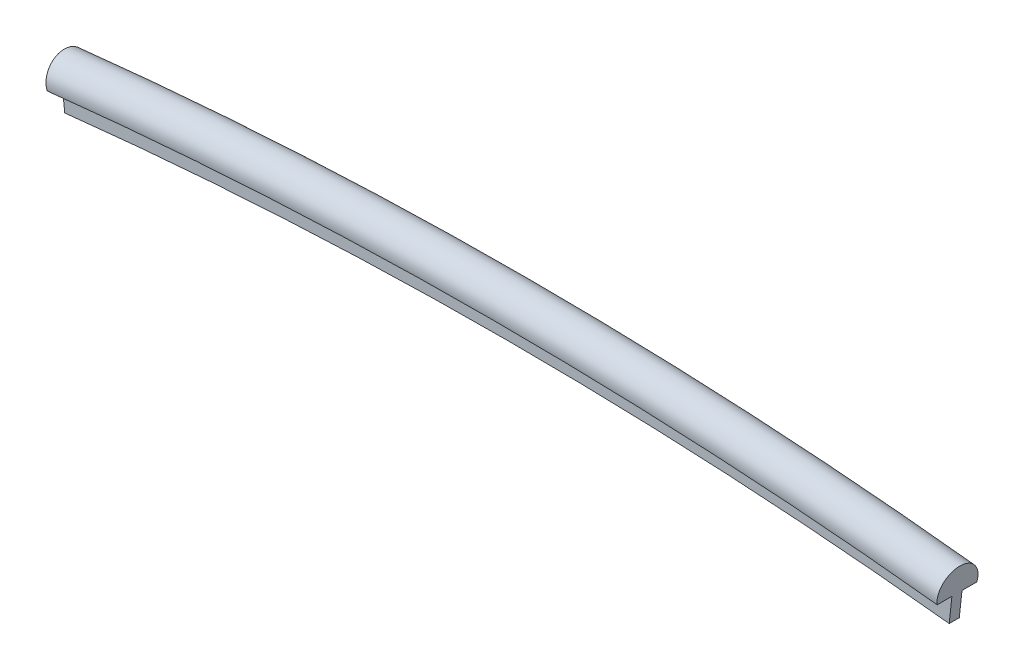
from build123d import *

# Parameters (mm, degrees)
REVOLVE1_ANGLE           = 6.308952124
REVOLVE1_OTHER_WAY_ANGLE = 6.308952124


with BuildPart() as part:
    # Sketch2 → Revolve1 (revolve)
    with BuildSketch(Plane(origin=(0, 0, 0), x_dir=(0, 0, -1), z_dir=(1, 0, 0))):
        with BuildLine():
            Line((0, 239.8), (0.3, 239.8))
            Line((0.3, 239.8), (0.3, 241.3))
            Line((0.3, 241.3), (1.18, 241.3))
            ThreePointArc((1.18, 241.3), (0, 242.800182019), (-1.18, 241.3))
            Line((-1.18, 241.3), (-0.3, 241.3))
            Line((-0.3, 241.3), (-0.3, 239.8))
            Line((-0.3, 239.8), (0, 239.8))
        make_face()
    revolve(axis=Axis((0, 0, 70.597641597), (0, 0, -1)), revolution_arc=REVOLVE1_ANGLE)

    # Sketch2 → Revolve1 other way (revolve)
    with BuildSketch(Plane(origin=(0, 0, 0), x_dir=(0, 0, -1), z_dir=(1, 0, 0))):
        with BuildLine():
            Line((0, 239.8), (0.3, 239.8))
            Line((0.3, 239.8), (0.3, 241.3))
            Line((0.3, 241.3), (1.18, 241.3))
            ThreePointArc((1.18, 241.3), (0, 242.800182019), (-1.18, 241.3))
            Line((-1.18, 241.3), (-0.3, 241.3))
            Line((-0.3, 241.3), (-0.3, 239.8))
            Line((-0.3, 239.8), (0, 239.8))
        make_face()
    revolve(axis=Axis((0, 0, 70.597641597), (0, 0, 1)), revolution_arc=REVOLVE1_OTHER_WAY_ANGLE)


solid = part.part
